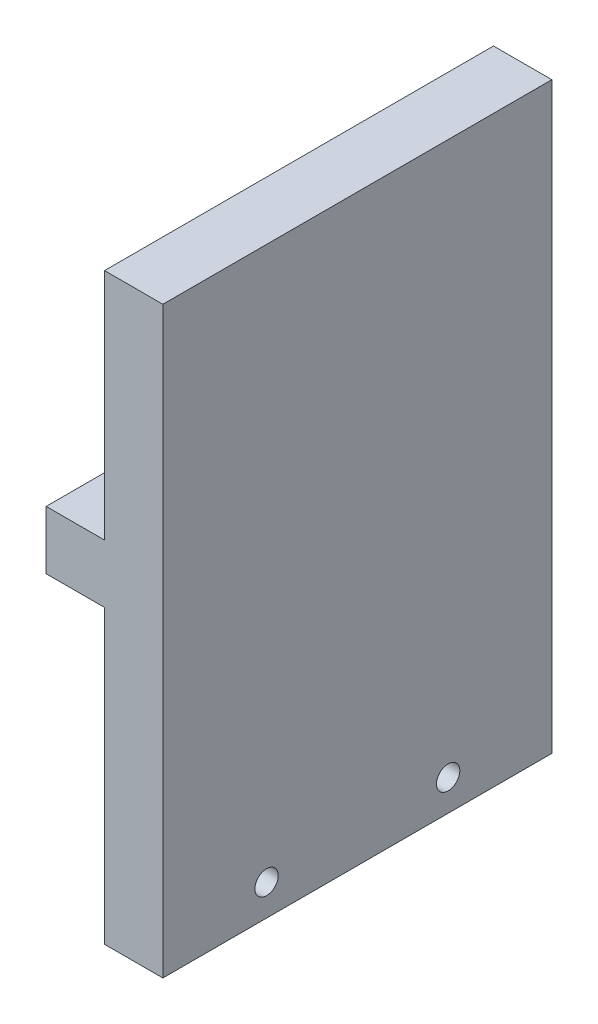
from build123d import *

# Parameters (mm, degrees)
CROQUIS1_W              = 100
CROQUIS1_H              = 150
SALIENTE_EXTRUIR1_DEPTH = 15
CROQUIS2_W              = 35
CROQUIS2_H              = 15
SALIENTE_EXTRUIR2_DEPTH = 15
CROQUIS3_R              = 3
CORTAR_EXTRUIR1_DEPTH   = 96


with BuildPart() as part:
    # Croquis1 → Saliente-Extruir1 (new body)
    with BuildSketch(Plane(origin=(0, 0, 0), x_dir=(0, 0, -1), z_dir=(1, 0, 0))):
        Rectangle(CROQUIS1_W, CROQUIS1_H)
    extrude(amount=SALIENTE_EXTRUIR1_DEPTH)

    # Croquis2 → Saliente-Extruir2 (add)
    with BuildSketch(Plane.ZY):
        with Locations((32.5, 7.5)):
            Rectangle(CROQUIS2_W, CROQUIS2_H)
        with Locations((-32.5, -7.5)):
            Rectangle(CROQUIS2_W, CROQUIS2_H)
    extrude(amount=SALIENTE_EXTRUIR2_DEPTH)

    # Croquis3 → Cortar-Extruir1 (cut, through all)
    with BuildSketch(Plane(origin=(15, 0, 0), x_dir=(0, 0, -1), z_dir=(1, 0, 0))):
        with Locations((-23.345, -67)):
            Circle(CROQUIS3_R)
        with Locations((23.345, -67)):
            Circle(CROQUIS3_R)
    extrude(amount=-CORTAR_EXTRUIR1_DEPTH, mode=Mode.SUBTRACT)


solid = part.part
